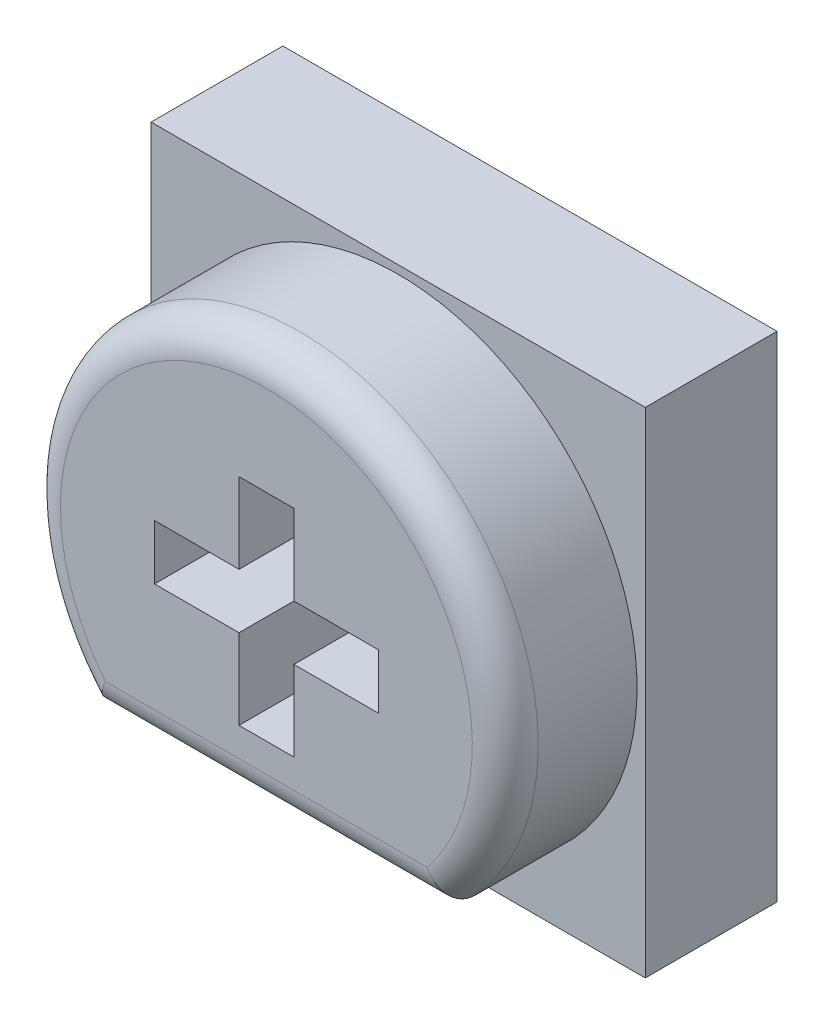
from build123d import *

# Parameters (mm, degrees)
SKETCH1_W           = 3
SKETCH1_H           = 3
BOSS_EXTRUDE1_DEPTH = 0.8
BOSS_EXTRUDE2_DEPTH = 0.8
CUT_EXTRUDE1_DEPTH  = 0.8
FILLET1_R           = 0.2


with BuildPart() as part:
    # Sketch1 → Boss-Extrude1 (new body)
    with BuildSketch(Plane.XY):
        Rectangle(SKETCH1_W, SKETCH1_H)
    extrude(amount=BOSS_EXTRUDE1_DEPTH)

    # Sketch2 → Boss-Extrude2 (add)
    with BuildSketch(Plane.XY.offset(0.8)):
        with BuildLine():
            Line((-1.068624141, -0.980072674), (1.068624141, -0.980072674))
            ThreePointArc((1.068624141, -0.980072674), (0, 1.45), (-1.068624141, -0.980072674))
        make_face()
    extrude(amount=BOSS_EXTRUDE2_DEPTH)

    # Sketch3 → Cut-Extrude1 (cut)
    with BuildSketch(Plane.XY.offset(1.6)):
        Polygon((-0.166229868, 0.215595899), (-0.166229868, 0.702775387), (0.167103465, 0.702775387), (0.167103465, 0.215595899), (0.679923978, 0.215595899), (0.679923978, -0.117737434), (0.167103465, -0.117737434), (0.167103465, -0.604916921), (-0.166229868, -0.604916921), (-0.166229868, -0.117737434), (-0.679050381, -0.117737434), (-0.679050381, 0.215595899), align=None)
    extrude(amount=-CUT_EXTRUDE1_DEPTH, mode=Mode.SUBTRACT)

    # Fillet1
    fillet1_edges = [part.edges().sort_by_distance(p)[0] for p in [
        (0, 1.45, 1.6),
        (0, -0.980072674, 1.6),
    ]]
    fillet(fillet1_edges, radius=FILLET1_R)


solid = part.part
